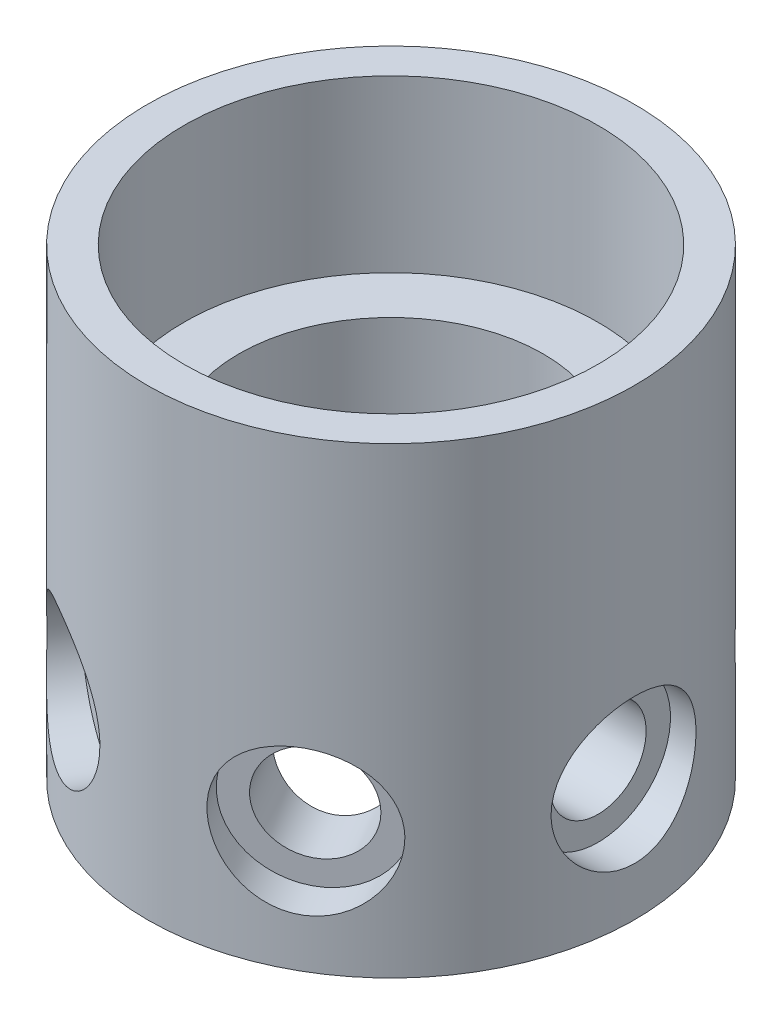
from build123d import *

# Parameters (mm, degrees)
SKETCH1_R           = 20
BOSS_EXTRUDE1_DEPTH = 38
SKETCH2_R           = 12.5
CUT_EXTRUDE1_DEPTH  = 38
SKETCH3_R           = 17
CUT_EXTRUDE2_DEPTH  = 14


with BuildPart() as part:
    # Sketch1 → Boss-Extrude1 (new body)
    with BuildSketch(Plane(origin=(0, 0, 0), x_dir=(1, 0, 0), z_dir=(0, 1, 0))):
        with Locations(Location((0, 0, 0), (0, 0, 270))):
            Circle(SKETCH1_R)
    extrude(amount=BOSS_EXTRUDE1_DEPTH)

    # Sketch2 → Cut-Extrude1 (cut)
    with BuildSketch(Plane(origin=(0, 38, 0), x_dir=(1, 0, 0), z_dir=(0, 1, 0))):
        with Locations(Location((0, 0, 0), (0, 0, 270))):
            Circle(SKETCH2_R)
    extrude(amount=-CUT_EXTRUDE1_DEPTH, mode=Mode.SUBTRACT)

    # Sketch3 → Cut-Extrude2 (cut)
    with BuildSketch(Plane(origin=(0, 38, 0), x_dir=(1, 0, 0), z_dir=(0, 1, 0))):
        with Locations(Location((0, 0, 0), (0, 0, 270))):
            Circle(SKETCH3_R)
    extrude(amount=-CUT_EXTRUDE2_DEPTH, mode=Mode.SUBTRACT)

    # Sketch7 → Cut-Revolve4 (revolve, cut)
    with BuildSketch(Plane.XY, mode=Mode.PRIVATE) as cut_revolve4_sk:
        Polygon((-17, 6), (17, 6), (17, 4), (20, 4), (20, 9.95), (-20, 9.95), (-20, 4), (-17, 4), align=None)
    revolve(cut_revolve4_sk.sketch.rotate(Axis((-20, 9.95, 0), (1, 0, 0)), 270), axis=Axis((-20, 9.95, 0), (1, 0, 0)), mode=Mode.SUBTRACT)

    # Sketch10 → Cut-Revolve5 (revolve, cut)
    with BuildSketch(Plane(origin=(0, 0, 0), x_dir=(-0.5000000000000039, 0, -0.8660254037844365), z_dir=(0.8660254037844364, 0, -0.5000000000000038)), mode=Mode.PRIVATE) as cut_revolve5_sk:
        Polygon((-17, 6), (17, 6), (17, 4), (20, 4), (20, 9.95), (-20, 9.95), (-20, 4), (-17, 4), align=None)
    revolve(cut_revolve5_sk.sketch.rotate(Axis((10, 9.95, 17.320508076), (-0.5000000000000039, 0, -0.8660254037844365)), 270), axis=Axis((10, 9.95, 17.320508076), (-0.5000000000000039, 0, -0.8660254037844365)), mode=Mode.SUBTRACT)

    # Sketch11 → Cut-Revolve6 (revolve, cut)
    with BuildSketch(Plane(origin=(0, 0, 0), x_dir=(0.49999999999999833, 0, -0.8660254037844396), z_dir=(0.8660254037844397, 0, 0.4999999999999984)), mode=Mode.PRIVATE) as cut_revolve6_sk:
        Polygon((-17, 6), (17, 6), (17, 4), (20, 4), (20, 9.95), (-20, 9.95), (-20, 4), (-17, 4), align=None)
    revolve(cut_revolve6_sk.sketch.rotate(Axis((-10, 9.95, 17.320508076), (0.49999999999999833, 0, -0.8660254037844397)), 270), axis=Axis((-10, 9.95, 17.320508076), (0.49999999999999833, 0, -0.8660254037844397)), mode=Mode.SUBTRACT)


solid = part.part
